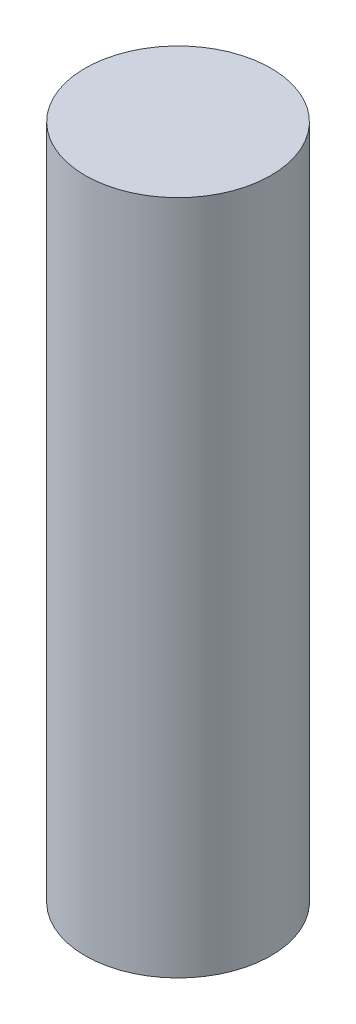
from build123d import *

# Parameters (mm, degrees)
SKETCH1_R           = 27.5
BOSS_EXTRUDE1_DEPTH = 200


with BuildPart() as part:
    # Sketch1 → Boss-Extrude1 (new body)
    with BuildSketch(Plane(origin=(0, 0, 0), x_dir=(1, 0, 0), z_dir=(0, 1, 0))):
        with Locations(Location((0, 0, 0), (0, 0, 270))):
            Circle(SKETCH1_R)
    extrude(amount=BOSS_EXTRUDE1_DEPTH)


solid = part.part
